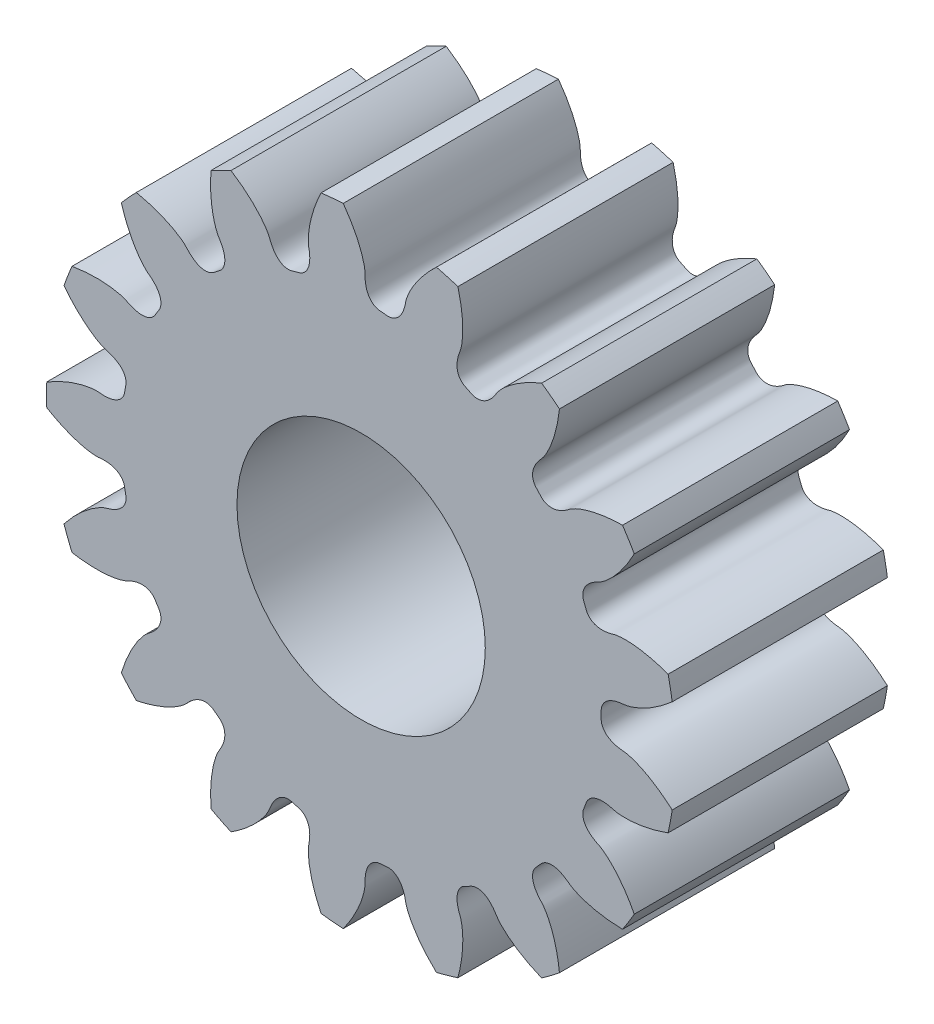
from build123d import *

# Parameters (mm, degrees)
SKETCH_292_W               = 13
SKETCH_292_H               = 18.999999715
CUT_EXTRUDE_531_DEPTH      = 10
PATTERN_CIRCULAR_585_COUNT = 17
SKETCH_620_W               = 20
SKETCH_620_H               = 7.5


with BuildPart() as part:
    # Sketch 292 → Revolve 355 (revolve)
    with BuildSketch(Plane(origin=(0, 0, 0), x_dir=(0, 0, -1), z_dir=(1, 0, 0))):
        with Locations((-3.5, 9.499999858)):
            Rectangle(SKETCH_292_W, SKETCH_292_H)
    revolve(axis=Axis((0, 0, 0), (0, 0, -1)))

    # Sketch 400 → Cut-Extrude 531 (cut, symmetric)
    with BuildSketch(Plane.XY):
        with BuildLine():
            ThreePointArc((18.877658909, 2.905853259), (19.099999713, 0), (18.877658909, -2.905853259))
            add(Edge.make_bspline(
                [(18.877658909, -2.905853259), (18.716157077, -2.760491903), (18.473674685, -2.555466773), (18.146231854, -2.305800395), (17.915616582, -2.141617068), (17.694045744, -1.994557675), (17.482378444, -1.863843394), (17.281432145, -1.748657621), (17.091981124, -1.648148349), (16.91475505, -1.561430027), (16.75043763, -1.487585558), (16.599665344, -1.425668538), (16.463026276, -1.374704812), (16.341059011, -1.333696439), (16.234251655, -1.301618374), (16.143040872, -1.277437356), (16.067811224, -1.260066189), (16.008893984, -1.248498433), (15.908190545, -1.231787486), (15.807316828, -1.229114573), (15.703657001, -1.215951521), (15.649467568, -1.208331777), (15.596258759, -1.199646448), (15.544003852, -1.190006775), (15.492690854, -1.17937343), (15.442301512, -1.167741383), (15.392816806, -1.155090622), (15.344215565, -1.141398119), (15.296474978, -1.126633588), (15.249570732, -1.110759317), (15.203477429, -1.093728751), (15.158169165, -1.075485196), (15.113620398, -1.05596029), (15.069807181, -1.035072325), (15.026708876, -1.012724457), (14.984310506, -0.988802839), (14.942605916, -0.963174827), (14.901601952, -0.935687429), (14.861323874, -0.906166316), (14.821822218, -0.874415841), (14.78318124, -0.840220712), (14.745528928, -0.803350183), (14.709048241, -0.76356583), (14.67398879, -0.720634147), (14.640677395, -0.674345103), (14.609525194, -0.624537363), (14.581027601, -0.571129886), (14.555754764, -0.514157513), (14.534322936, -0.45380698), (14.517368695, -0.390442448), (14.50543648, -0.324626756), (14.499650458, -0.262572046), (14.497192375, -0.154189358), (14.502240728, 0), (14.497192375, 0.154189358), (14.499650458, 0.262572046), (14.50543648, 0.324626756), (14.517368695, 0.390442448), (14.534322936, 0.45380698), (14.555754764, 0.514157513), (14.581027601, 0.571129886), (14.609525194, 0.624537363), (14.640677395, 0.674345103), (14.67398879, 0.720634147), (14.709048241, 0.76356583), (14.745528928, 0.803350183), (14.78318124, 0.840220712), (14.821822218, 0.874415841), (14.861323874, 0.906166316), (14.901601952, 0.935687429), (14.942605916, 0.963174827), (14.984310506, 0.988802839), (15.026708876, 1.012724457), (15.069807181, 1.035072325), (15.113620398, 1.05596029), (15.158169165, 1.075485196), (15.203477429, 1.093728751), (15.249570732, 1.110759317), (15.296474978, 1.126633588), (15.344215565, 1.141398119), (15.392816806, 1.155090622), (15.442301512, 1.167741383), (15.492690854, 1.17937343), (15.544003852, 1.190006775), (15.596258759, 1.199646448), (15.649467568, 1.208331777), (15.703657001, 1.215951521), (15.807316828, 1.229114573), (15.908190545, 1.231787486), (16.008893984, 1.248498433), (16.067811224, 1.260066189), (16.143040872, 1.277437356), (16.234251655, 1.301618374), (16.341059011, 1.333696439), (16.463026276, 1.374704812), (16.599665344, 1.425668538), (16.75043763, 1.487585558), (16.91475505, 1.561430027), (17.091981124, 1.648148349), (17.281432145, 1.748657621), (17.482378444, 1.863843394), (17.694045744, 1.994557675), (17.915616582, 2.141617068), (18.146231854, 2.305800395), (18.473674685, 2.555466773), (18.716157077, 2.760491903), (18.877658909, 2.905853259)],
                knots=[0, 0, 0, 0, 0.058344307, 0.085213395, 0.110547108, 0.134345443, 0.156608403, 0.177335985, 0.196528192, 0.214185022, 0.230306475, 0.244892552, 0.257943253, 0.269458577, 0.279438525, 0.287883097, 0.294792293, 0.300166112, 0.304004555, 0.322189706, 0.327162426, 0.332059271, 0.336883274, 0.34163777, 0.346326431, 0.350953304, 0.355522857, 0.360040026, 0.364510274, 0.368939642, 0.373334824, 0.377703228, 0.382053055, 0.38639337, 0.390734176, 0.395086475, 0.399462319, 0.403874831, 0.408338175, 0.412867469, 0.417478596, 0.42218788, 0.4270116, 0.431965278, 0.437062734, 0.442314886, 0.447728346, 0.453303917, 0.459035192, 0.46490754, 0.470897788, 0.47697488, 0.481620748, 0.5, 0.518379252, 0.52302512, 0.529102212, 0.53509246, 0.540964808, 0.546696083, 0.552271654, 0.557685114, 0.562937266, 0.568034722, 0.5729884, 0.57781212, 0.582521404, 0.587132531, 0.591661825, 0.596125169, 0.600537681, 0.604913525, 0.609265824, 0.61360663, 0.617946945, 0.622296772, 0.626665176, 0.631060358, 0.635489726, 0.639959974, 0.644477143, 0.649046696, 0.653673569, 0.65836223, 0.663116726, 0.667940729, 0.672837574, 0.677810294, 0.695995445, 0.699833888, 0.705207707, 0.712116903, 0.720561475, 0.730541423, 0.742056747, 0.755107448, 0.769693525, 0.785814978, 0.803471808, 0.822664015, 0.843391597, 0.865654557, 0.889452892, 0.914786605, 0.941655693, 1, 1, 1, 1], degree=3))
        make_face()
    cut_extrude_531 = extrude(amount=CUT_EXTRUDE_531_DEPTH, both=True, mode=Mode.SUBTRACT)

    # Pattern Circular 585: Cut-Extrude 531 ×17 about axis
    pattern_circular_585_axis = Axis((0, 0, 55), (0, 0, -1))
    for i in range(1, PATTERN_CIRCULAR_585_COUNT):
        add(cut_extrude_531.rotate(pattern_circular_585_axis, i * 360 / PATTERN_CIRCULAR_585_COUNT), mode=Mode.SUBTRACT)

    # Sketch 620 → Cut-Revolve 681 (revolve, cut)
    with BuildSketch(Plane(origin=(0, 0, 0), x_dir=(0, 0, -1), z_dir=(1, 0, 0))):
        with Locations((0, 3.75)):
            Rectangle(SKETCH_620_W, SKETCH_620_H)
    revolve(axis=Axis((0, 0, 0), (0, 0, -1)), mode=Mode.SUBTRACT)


solid = part.part
